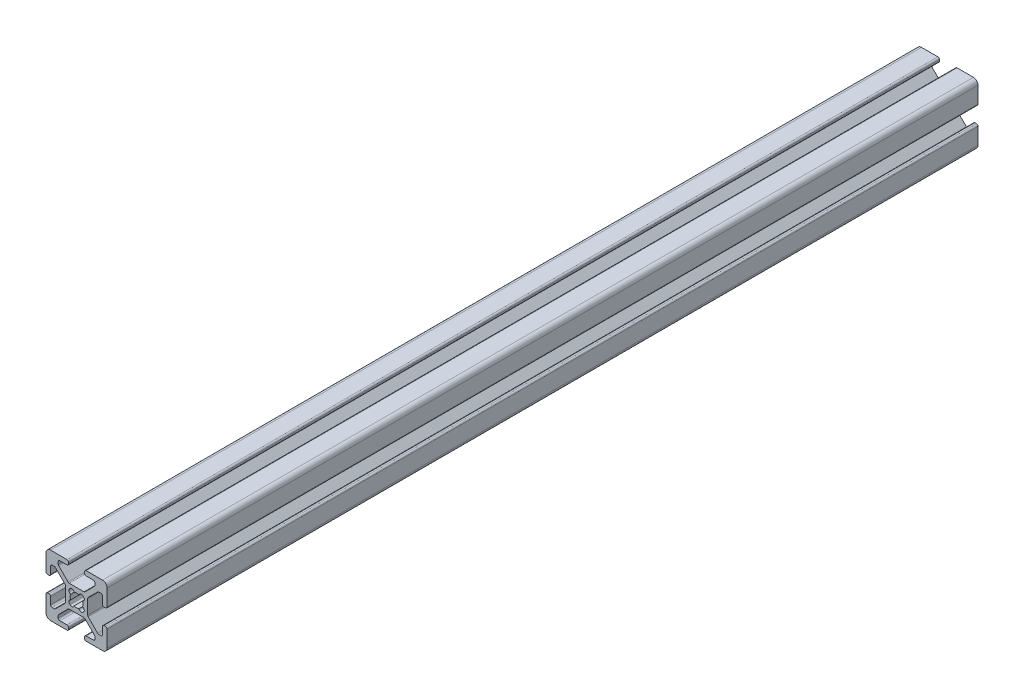
from build123d import *

# Parameters (mm, degrees)
EXTRUDE1_DEPTH = 285


with BuildPart() as part:
    # Sketch1 → Extrude1 (new body)
    with BuildSketch(Plane.XY):
        with BuildLine():
            Line((-5.032287798, -0.341059771), (-5.516287798, -0.341059771))
            ThreePointArc((-5.516287798, -0.341059771), (-5.875498042, -0.192270016), (-6.024287798, 0.166940229))
            Line((-6.024287798, 0.166940229), (-6.024287798, 2.515940229))
            ThreePointArc((-6.024287798, 2.515940229), (-6.173077553, 2.875150474), (-6.532287798, 3.023940229))
            Line((-6.532287798, 3.023940229), (-7.258207136, 3.023940229))
            ThreePointArc((-7.258207136, 3.023940229), (-7.45261032, 2.985271032), (-7.617417381, 2.875150474))
            Line((-7.617417381, 2.875150474), (-10.720498042, -0.227930187))
            ThreePointArc((-10.720498042, -0.227930187), (-10.8306186, -0.392737249), (-10.869287798, -0.587140432))
            Line((-10.869287798, -0.587140432), (-10.869287798, -5.354979109))
            ThreePointArc((-10.869287798, -5.354979109), (-10.8306186, -5.549382293), (-10.720498042, -5.714189354))
            Line((-10.720498042, -5.714189354), (-7.617417381, -8.817270016))
            ThreePointArc((-7.617417381, -8.817270016), (-7.45261032, -8.927390573), (-7.258207136, -8.966059771))
            Line((-7.258207136, -8.966059771), (-6.532287798, -8.966059771))
            ThreePointArc((-6.532287798, -8.966059771), (-6.173077553, -8.817270016), (-6.024287798, -8.458059771))
            Line((-6.024287798, -8.458059771), (-6.024287798, -6.109059771))
            ThreePointArc((-6.024287798, -6.109059771), (-5.875498042, -5.749849526), (-5.516287798, -5.601059771))
            Line((-5.516287798, -5.601059771), (-5.032287798, -5.601059771))
            ThreePointArc((-5.032287798, -5.601059771), (-4.673077553, -5.749849526), (-4.524287798, -6.109059771))
            Line((-4.524287798, -6.109059771), (-4.524287798, -11.471059771))
            ThreePointArc((-4.524287798, -11.471059771), (-4.963627626, -12.531719943), (-6.024287798, -12.971059771))
            Line((-6.024287798, -12.971059771), (-11.386287798, -12.971059771))
            ThreePointArc((-11.386287798, -12.971059771), (-11.745498042, -12.822270016), (-11.894287798, -12.463059771))
            Line((-11.894287798, -12.463059771), (-11.894287798, -11.979059771))
            ThreePointArc((-11.894287798, -11.979059771), (-11.745498042, -11.619849526), (-11.386287798, -11.471059771))
            Line((-11.386287798, -11.471059771), (-9.037287798, -11.471059771))
            ThreePointArc((-9.037287798, -11.471059771), (-8.678077553, -11.322270016), (-8.529287798, -10.963059771))
            Line((-8.529287798, -10.963059771), (-8.529287798, -10.237140432))
            ThreePointArc((-8.529287798, -10.237140432), (-8.567956995, -10.042737249), (-8.678077553, -9.877930187))
            Line((-8.678077553, -9.877930187), (-11.781158214, -6.774849526))
            ThreePointArc((-11.781158214, -6.774849526), (-11.945965275, -6.664728968), (-12.140368459, -6.626059771))
            Line((-12.140368459, -6.626059771), (-16.908207136, -6.626059771))
            ThreePointArc((-16.908207136, -6.626059771), (-17.10261032, -6.664728968), (-17.267417381, -6.774849526))
            Line((-17.267417381, -6.774849526), (-20.370498042, -9.877930187))
            ThreePointArc((-20.370498042, -9.877930187), (-20.4806186, -10.042737249), (-20.519287798, -10.237140432))
            Line((-20.519287798, -10.237140432), (-20.519287798, -10.963059771))
            ThreePointArc((-20.519287798, -10.963059771), (-20.370498042, -11.322270016), (-20.011287798, -11.471059771))
            Line((-20.011287798, -11.471059771), (-17.662287798, -11.471059771))
            ThreePointArc((-17.662287798, -11.471059771), (-17.303077553, -11.619849526), (-17.154287798, -11.979059771))
            Line((-17.154287798, -11.979059771), (-17.154287798, -12.463059771))
            ThreePointArc((-17.154287798, -12.463059771), (-17.303077553, -12.822270016), (-17.662287798, -12.971059771))
            Line((-17.662287798, -12.971059771), (-23.024287798, -12.971059771))
            ThreePointArc((-23.024287798, -12.971059771), (-24.084947969, -12.531719943), (-24.524287798, -11.471059771))
            Line((-24.524287798, -11.471059771), (-24.524287798, -6.109059771))
            ThreePointArc((-24.524287798, -6.109059771), (-24.375498042, -5.749849526), (-24.016287798, -5.601059771))
            Line((-24.016287798, -5.601059771), (-23.532287798, -5.601059771))
            ThreePointArc((-23.532287798, -5.601059771), (-23.173077553, -5.749849526), (-23.024287798, -6.109059771))
            Line((-23.024287798, -6.109059771), (-23.024287798, -8.458059771))
            ThreePointArc((-23.024287798, -8.458059771), (-22.875498042, -8.817270016), (-22.516287798, -8.966059771))
            Line((-22.516287798, -8.966059771), (-21.790368459, -8.966059771))
            ThreePointArc((-21.790368459, -8.966059771), (-21.595965275, -8.927390573), (-21.431158214, -8.817270016))
            Line((-21.431158214, -8.817270016), (-18.328077553, -5.714189354))
            ThreePointArc((-18.328077553, -5.714189354), (-18.217956995, -5.549382293), (-18.179287798, -5.354979109))
            Line((-18.179287798, -5.354979109), (-18.179287798, -0.587140432))
            ThreePointArc((-18.179287798, -0.587140432), (-18.217956995, -0.392737249), (-18.328077553, -0.227930187))
            Line((-18.328077553, -0.227930187), (-21.431158214, 2.875150474))
            ThreePointArc((-21.431158214, 2.875150474), (-21.595965275, 2.985271032), (-21.790368459, 3.023940229))
            Line((-21.790368459, 3.023940229), (-22.516287798, 3.023940229))
            ThreePointArc((-22.516287798, 3.023940229), (-22.875498042, 2.875150474), (-23.024287798, 2.515940229))
            Line((-23.024287798, 2.515940229), (-23.024287798, 0.166940229))
            ThreePointArc((-23.024287798, 0.166940229), (-23.173077553, -0.192270016), (-23.532287798, -0.341059771))
            Line((-23.532287798, -0.341059771), (-24.016287798, -0.341059771))
            ThreePointArc((-24.016287798, -0.341059771), (-24.375498042, -0.192270016), (-24.524287798, 0.166940229))
            Line((-24.524287798, 0.166940229), (-24.524287798, 5.528940229))
            ThreePointArc((-24.524287798, 5.528940229), (-24.084947969, 6.589600401), (-23.024287798, 7.028940229))
            Line((-23.024287798, 7.028940229), (-17.662287798, 7.028940229))
            ThreePointArc((-17.662287798, 7.028940229), (-17.303077553, 6.880150474), (-17.154287798, 6.520940229))
            Line((-17.154287798, 6.520940229), (-17.154287798, 6.036940229))
            ThreePointArc((-17.154287798, 6.036940229), (-17.303077553, 5.677729984), (-17.662287798, 5.528940229))
            Line((-17.662287798, 5.528940229), (-20.011287798, 5.528940229))
            ThreePointArc((-20.011287798, 5.528940229), (-20.370498042, 5.380150474), (-20.519287798, 5.020940229))
            Line((-20.519287798, 5.020940229), (-20.519287798, 4.295020891))
            ThreePointArc((-20.519287798, 4.295020891), (-20.4806186, 4.100617707), (-20.370498042, 3.935810646))
            Line((-20.370498042, 3.935810646), (-17.267417381, 0.832729984))
            ThreePointArc((-17.267417381, 0.832729984), (-17.10261032, 0.722609427), (-16.908207136, 0.683940229))
            Line((-16.908207136, 0.683940229), (-12.140368459, 0.683940229))
            ThreePointArc((-12.140368459, 0.683940229), (-11.945965275, 0.722609427), (-11.781158214, 0.832729984))
            Line((-11.781158214, 0.832729984), (-8.678077553, 3.935810646))
            ThreePointArc((-8.678077553, 3.935810646), (-8.567956995, 4.100617707), (-8.529287798, 4.295020891))
            Line((-8.529287798, 4.295020891), (-8.529287798, 5.020940229))
            ThreePointArc((-8.529287798, 5.020940229), (-8.678077553, 5.380150474), (-9.037287798, 5.528940229))
            Line((-9.037287798, 5.528940229), (-11.386287798, 5.528940229))
            ThreePointArc((-11.386287798, 5.528940229), (-11.745498042, 5.677729984), (-11.894287798, 6.036940229))
            Line((-11.894287798, 6.036940229), (-11.894287798, 6.520940229))
            ThreePointArc((-11.894287798, 6.520940229), (-11.745498042, 6.880150474), (-11.386287798, 7.028940229))
            Line((-11.386287798, 7.028940229), (-6.024287798, 7.028940229))
            ThreePointArc((-6.024287798, 7.028940229), (-4.963627626, 6.589600401), (-4.524287798, 5.528940229))
            Line((-4.524287798, 5.528940229), (-4.524287798, 0.166940229))
            ThreePointArc((-4.524287798, 0.166940229), (-4.673077553, -0.192270016), (-5.032287798, -0.341059771))
        make_face()
        with BuildLine():
            Line((-12.399386954, -5.275565737), (-12.219781831, -5.095960615))
            ThreePointArc((-12.219781831, -5.095960615), (-12.018349781, -4.327527582), (-12.589154291, -3.775036489))
            ThreePointArc((-12.589154291, -3.775036489), (-12.428787798, -2.971059771), (-12.589154291, -2.167083053))
            ThreePointArc((-12.589154291, -2.167083053), (-12.018349781, -1.61459196), (-12.219781831, -0.846158927))
            Line((-12.219781831, -0.846158927), (-12.399386954, -0.666553805))
            ThreePointArc((-12.399386954, -0.666553805), (-13.167819987, -0.465121754), (-13.72031108, -1.035926265))
            ThreePointArc((-13.72031108, -1.035926265), (-14.524287798, -0.875559771), (-15.328264516, -1.035926265))
            ThreePointArc((-15.328264516, -1.035926265), (-15.880755608, -0.465121754), (-16.649188641, -0.666553805))
            Line((-16.649188641, -0.666553805), (-16.828793764, -0.846158927))
            ThreePointArc((-16.828793764, -0.846158927), (-17.030225814, -1.61459196), (-16.459421304, -2.167083053))
            ThreePointArc((-16.459421304, -2.167083053), (-16.619787798, -2.971059771), (-16.459421304, -3.775036489))
            ThreePointArc((-16.459421304, -3.775036489), (-17.030225814, -4.327527582), (-16.828793764, -5.095960615))
            Line((-16.828793764, -5.095960615), (-16.649188641, -5.275565737))
            ThreePointArc((-16.649188641, -5.275565737), (-15.880755608, -5.476997788), (-15.328264516, -4.906193277))
            ThreePointArc((-15.328264516, -4.906193277), (-14.524287798, -5.066559771), (-13.72031108, -4.906193277))
            ThreePointArc((-13.72031108, -4.906193277), (-13.167819987, -5.476997788), (-12.399386954, -5.275565737))
        make_face(mode=Mode.SUBTRACT)
    extrude(amount=EXTRUDE1_DEPTH)


solid = part.part
